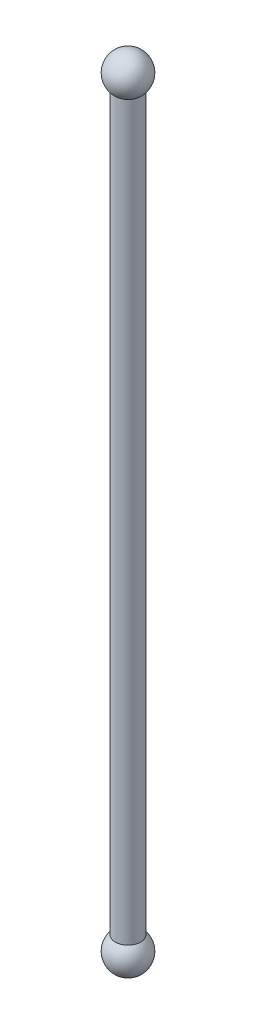
from build123d import *

# Parameters (mm, degrees)
SKETCH_2_R      = 5
EXTRUDE_1_DEPTH = 150


with BuildPart() as part:
    # 草图2 → 凸台-拉伸1 (new, symmetric)
    with BuildSketch(Plane(origin=(0, 0, 0), x_dir=(1, 0, 0), z_dir=(0, 1, 0))):
        with Locations(Location((0, 0, 0), (0, 0, 270))):
            Circle(SKETCH_2_R)
    extrude(amount=EXTRUDE_1_DEPTH, both=True)

    # 草图3 → 旋转1 (revolve)
    with BuildSketch(Plane.XY):
        with BuildLine():
            Line((0, 157.5), (0, 142.5))
            ThreePointArc((0, 142.5), (7.5, 150), (0, 157.5))
        make_face()
    revolve_1 = revolve(axis=Axis((0, 157.5, 0), (0, -1, 0)))

    # 镜向1: 旋转1 across plane
    add(revolve_1.mirror(Plane.ZX))


solid = part.part
